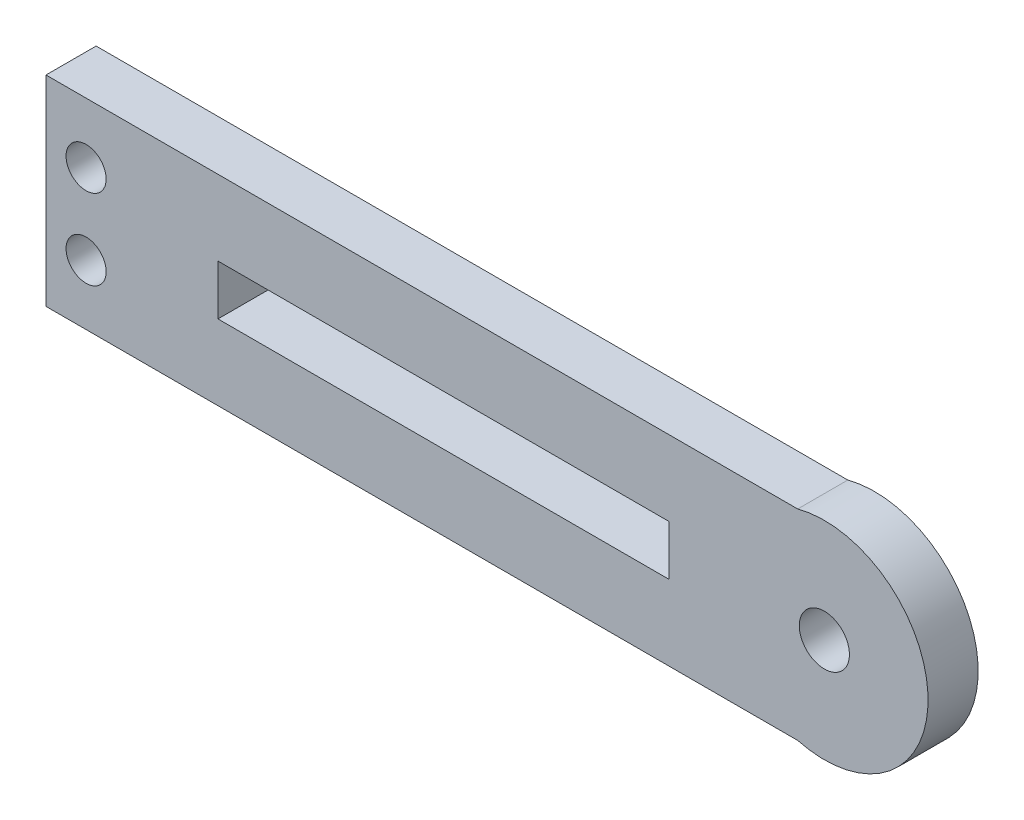
from build123d import *

# Parameters (mm, degrees)
SCHIZZO1_R                   = 2.5
ESTRUSIONE_ESTRUSIONE1_DEPTH = 5
SCHIZZO2_W                   = 45
SCHIZZO2_H                   = 5
TAGLIO_ESTRUSIONE1_DEPTH     = 89.755250064
SCHIZZO4_R                   = 2
TAGLIO_ESTRUSIONE2_DEPTH     = 89.755250064


with BuildPart() as part:
    # Schizzo1 → Estrusione-Estrusione1 (new body)
    with BuildSketch(Plane.XY):
        with BuildLine():
            Line((0, -10), (75, -10))
            ThreePointArc((75, -10), (88.008053395, 0), (75, 10))
            Line((75, 10), (0, 10))
            Line((0, 10), (0, -10))
        make_face()
        with Locations((77.660254038, 0)):
            Circle(SCHIZZO1_R, mode=Mode.SUBTRACT)
    extrude(amount=ESTRUSIONE_ESTRUSIONE1_DEPTH)

    # Schizzo2 → Taglio-Estrusione1 (cut, through all)
    with BuildSketch(Plane.XY.offset(5)):
        with Locations((39.658388278, 0)):
            Rectangle(SCHIZZO2_W, SCHIZZO2_H)
    extrude(amount=-TAGLIO_ESTRUSIONE1_DEPTH, mode=Mode.SUBTRACT)

    # Schizzo4 → Taglio-Estrusione2 (cut, through all)
    with BuildSketch(Plane.XY.offset(5)):
        with Locations((4, 4)):
            Circle(SCHIZZO4_R)
        with Locations((4, -4)):
            Circle(SCHIZZO4_R)
    extrude(amount=-TAGLIO_ESTRUSIONE2_DEPTH, mode=Mode.SUBTRACT)


solid = part.part
